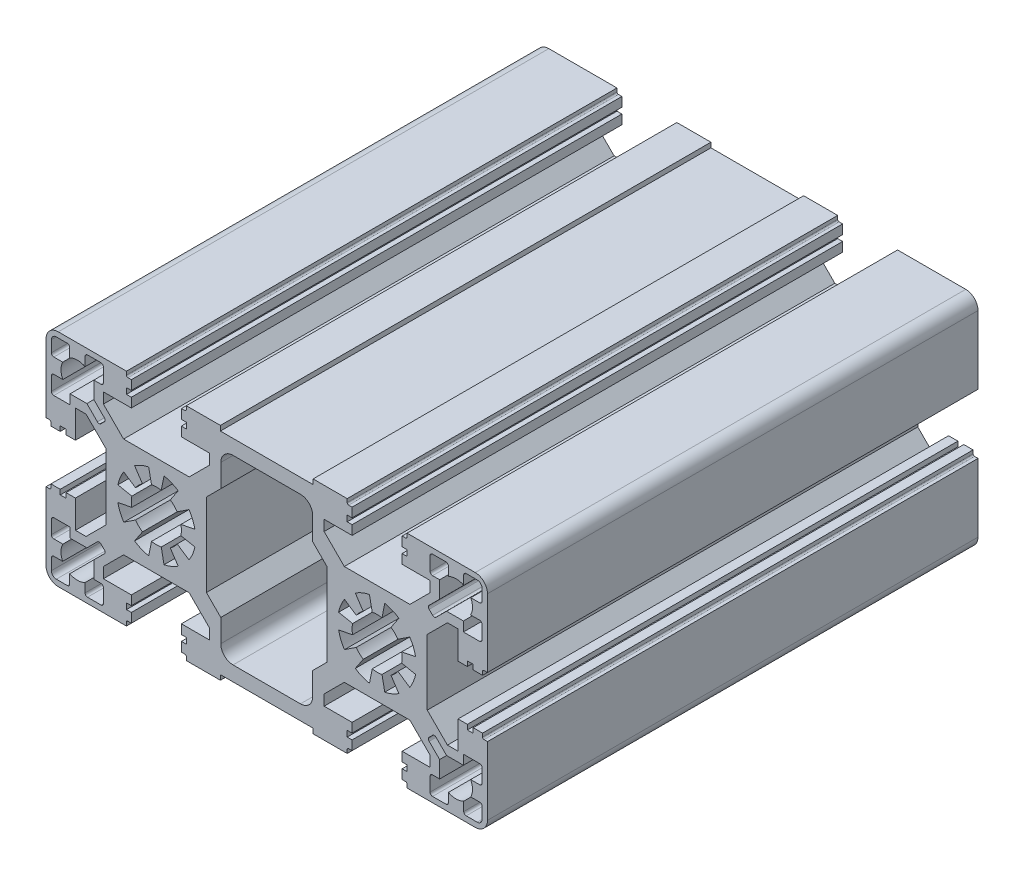
from build123d import *

# Parameters (mm, degrees)
EXTRUDE_1_DEPTH = 100


with BuildPart() as part:
    # 草图1 → 凸台-拉伸1 (new body)
    with BuildSketch(Plane.XY):
        with BuildLine():
            Line((-29.3856131, 22.954207574), (-43.2856131, 22.954207574))
            ThreePointArc((-43.2856131, 22.954207574), (-45.053380053, 22.221974527), (-45.7856131, 20.454207574))
            Line((-45.7856131, 20.454207574), (-45.7856131, 6.554207574))
            Line((-45.7856131, 6.554207574), (-45.0856131, 6.554207574))
            ThreePointArc((-45.0856131, 6.554207574), (-44.873481065, 6.466339608), (-44.7856131, 6.254207574))
            Line((-44.7856131, 6.254207574), (-44.7856131, 5.554207574))
            Line((-44.7856131, 5.554207574), (-42.8856131, 5.554207574))
            Line((-42.8856131, 5.554207574), (-42.8856131, 6.554207574))
            Line((-42.8856131, 6.554207574), (-41.6856131, 6.554207574))
            Line((-41.6856131, 6.554207574), (-41.6856131, 5.554207574))
            Line((-41.6856131, 5.554207574), (-39.7856131, 5.554207574))
            Line((-39.7856131, 5.554207574), (-39.7856131, 11.254207574))
            Line((-39.7856131, 11.254207574), (-37.621147006, 11.254207574))
            Line((-37.621147006, 11.254207574), (-33.5056131, 7.138673668))
            Line((-33.5056131, 7.138673668), (-33.5056131, -6.23025852))
            Line((-33.5056131, -6.23025852), (-37.621147006, -10.345792426))
            Line((-37.621147006, -10.345792426), (-39.7856131, -10.345792426))
            Line((-39.7856131, -10.345792426), (-39.7856131, -4.645792426))
            Line((-39.7856131, -4.645792426), (-41.6856131, -4.645792426))
            Line((-41.6856131, -4.645792426), (-41.6856131, -5.645792426))
            Line((-41.6856131, -5.645792426), (-42.8856131, -5.645792426))
            Line((-42.8856131, -5.645792426), (-42.8856131, -4.645792426))
            Line((-42.8856131, -4.645792426), (-44.7856131, -4.645792426))
            Line((-44.7856131, -4.645792426), (-44.7856131, -5.345792426))
            ThreePointArc((-44.7856131, -5.345792426), (-44.873481065, -5.557924461), (-45.0856131, -5.645792426))
            Line((-45.0856131, -5.645792426), (-45.7856131, -5.645792426))
            Line((-45.7856131, -5.645792426), (-45.7856131, -19.545792426))
            ThreePointArc((-45.7856131, -19.545792426), (-45.053380053, -21.313559379), (-43.2856131, -22.045792426))
            Line((-43.2856131, -22.045792426), (-29.3856131, -22.045792426))
            Line((-29.3856131, -22.045792426), (-29.3856131, -21.345792426))
            ThreePointArc((-29.3856131, -21.345792426), (-29.297745134, -21.133660392), (-29.0856131, -21.045792426))
            Line((-29.0856131, -21.045792426), (-28.3856131, -21.045792426))
            Line((-28.3856131, -21.045792426), (-28.3856131, -19.145792426))
            Line((-28.3856131, -19.145792426), (-29.3856131, -19.145792426))
            Line((-29.3856131, -19.145792426), (-29.3856131, -17.945792426))
            Line((-29.3856131, -17.945792426), (-28.3856131, -17.945792426))
            Line((-28.3856131, -17.945792426), (-28.3856131, -16.045792426))
            Line((-28.3856131, -16.045792426), (-34.0856131, -16.045792426))
            Line((-34.0856131, -16.045792426), (-34.0856131, -13.881326332))
            Line((-34.0856131, -13.881326332), (-29.970079194, -9.765792426))
            Line((-29.970079194, -9.765792426), (-16.601147006, -9.765792426))
            Line((-16.601147006, -9.765792426), (-12.4856131, -13.881326332))
            Line((-12.4856131, -13.881326332), (-12.4856131, -16.045792426))
            Line((-12.4856131, -16.045792426), (-18.1856131, -16.045792426))
            Line((-18.1856131, -16.045792426), (-18.1856131, -17.945792426))
            Line((-18.1856131, -17.945792426), (-17.1856131, -17.945792426))
            Line((-17.1856131, -17.945792426), (-17.1856131, -19.145792426))
            Line((-17.1856131, -19.145792426), (-18.1856131, -19.145792426))
            Line((-18.1856131, -19.145792426), (-18.1856131, -21.045792426))
            Line((-18.1856131, -21.045792426), (-17.4856131, -21.045792426))
            ThreePointArc((-17.4856131, -21.045792426), (-17.273481065, -21.133660392), (-17.1856131, -21.345792426))
            Line((-17.1856131, -21.345792426), (-17.1856131, -22.045792426))
            Line((-17.1856131, -22.045792426), (-10.2356131, -22.045792426))
            Line((-10.2356131, -22.045792426), (-10.2356131, -21.045792426))
            Line((-10.2356131, -21.045792426), (8.6643869, -21.045792426))
            Line((8.6643869, -21.045792426), (8.6643869, -22.045792426))
            Line((8.6643869, -22.045792426), (15.6143869, -22.045792426))
            Line((15.6143869, -22.045792426), (15.6143869, -21.345792426))
            ThreePointArc((15.6143869, -21.345792426), (15.702254866, -21.133660392), (15.9143869, -21.045792426))
            Line((15.9143869, -21.045792426), (16.6143869, -21.045792426))
            Line((16.6143869, -21.045792426), (16.6143869, -19.145792426))
            Line((16.6143869, -19.145792426), (15.6143869, -19.145792426))
            Line((15.6143869, -19.145792426), (15.6143869, -17.945792426))
            Line((15.6143869, -17.945792426), (16.6143869, -17.945792426))
            Line((16.6143869, -17.945792426), (16.6143869, -16.045792426))
            Line((16.6143869, -16.045792426), (10.9143869, -16.045792426))
            Line((10.9143869, -16.045792426), (10.9143869, -13.881326332))
            Line((10.9143869, -13.881326332), (15.029920806, -9.765792426))
            Line((15.029920806, -9.765792426), (28.398852994, -9.765792426))
            Line((28.398852994, -9.765792426), (32.5143869, -13.881326332))
            Line((32.5143869, -13.881326332), (32.5143869, -16.045792426))
            Line((32.5143869, -16.045792426), (26.8143869, -16.045792426))
            Line((26.8143869, -16.045792426), (26.8143869, -17.945792426))
            Line((26.8143869, -17.945792426), (27.8143869, -17.945792426))
            Line((27.8143869, -17.945792426), (27.8143869, -19.145792426))
            Line((27.8143869, -19.145792426), (26.8143869, -19.145792426))
            Line((26.8143869, -19.145792426), (26.8143869, -21.045792426))
            Line((26.8143869, -21.045792426), (27.5143869, -21.045792426))
            ThreePointArc((27.5143869, -21.045792426), (27.726518935, -21.133660392), (27.8143869, -21.345792426))
            Line((27.8143869, -21.345792426), (27.8143869, -22.045792426))
            Line((27.8143869, -22.045792426), (41.7143869, -22.045792426))
            ThreePointArc((41.7143869, -22.045792426), (43.482153853, -21.313559379), (44.2143869, -19.545792426))
            Line((44.2143869, -19.545792426), (44.2143869, -5.645792426))
            Line((44.2143869, -5.645792426), (43.5143869, -5.645792426))
            ThreePointArc((43.5143869, -5.645792426), (43.302254866, -5.557924461), (43.2143869, -5.345792426))
            Line((43.2143869, -5.345792426), (43.2143869, -4.645792426))
            Line((43.2143869, -4.645792426), (41.3143869, -4.645792426))
            Line((41.3143869, -4.645792426), (41.3143869, -5.645792426))
            Line((41.3143869, -5.645792426), (40.1143869, -5.645792426))
            Line((40.1143869, -5.645792426), (40.1143869, -4.645792426))
            Line((40.1143869, -4.645792426), (38.2143869, -4.645792426))
            Line((38.2143869, -4.645792426), (38.2143869, -10.345792426))
            Line((38.2143869, -10.345792426), (36.049920806, -10.345792426))
            Line((36.049920806, -10.345792426), (31.9343869, -6.23025852))
            Line((31.9343869, -6.23025852), (31.9343869, 7.138673668))
            Line((31.9343869, 7.138673668), (36.049920806, 11.254207574))
            Line((36.049920806, 11.254207574), (38.2143869, 11.254207574))
            Line((38.2143869, 11.254207574), (38.2143869, 5.554207574))
            Line((38.2143869, 5.554207574), (40.1143869, 5.554207574))
            Line((40.1143869, 5.554207574), (40.1143869, 6.554207574))
            Line((40.1143869, 6.554207574), (41.3143869, 6.554207574))
            Line((41.3143869, 6.554207574), (41.3143869, 5.554207574))
            Line((41.3143869, 5.554207574), (43.2143869, 5.554207574))
            Line((43.2143869, 5.554207574), (43.2143869, 6.254207574))
            ThreePointArc((43.2143869, 6.254207574), (43.302254866, 6.466339608), (43.5143869, 6.554207574))
            Line((43.5143869, 6.554207574), (44.2143869, 6.554207574))
            Line((44.2143869, 6.554207574), (44.2143869, 20.454207574))
            ThreePointArc((44.2143869, 20.454207574), (43.482153853, 22.221974527), (41.7143869, 22.954207574))
            Line((41.7143869, 22.954207574), (27.8143869, 22.954207574))
            Line((27.8143869, 22.954207574), (27.8143869, 22.254207574))
            ThreePointArc((27.8143869, 22.254207574), (27.726518935, 22.042075539), (27.5143869, 21.954207574))
            Line((27.5143869, 21.954207574), (26.8143869, 21.954207574))
            Line((26.8143869, 21.954207574), (26.8143869, 20.054207574))
            Line((26.8143869, 20.054207574), (27.8143869, 20.054207574))
            Line((27.8143869, 20.054207574), (27.8143869, 18.854207574))
            Line((27.8143869, 18.854207574), (26.8143869, 18.854207574))
            Line((26.8143869, 18.854207574), (26.8143869, 16.954207574))
            Line((26.8143869, 16.954207574), (32.5143869, 16.954207574))
            Line((32.5143869, 16.954207574), (32.5143869, 14.78974148))
            Line((32.5143869, 14.78974148), (28.398852994, 10.674207574))
            Line((28.398852994, 10.674207574), (15.029920806, 10.674207574))
            Line((15.029920806, 10.674207574), (10.9143869, 14.78974148))
            Line((10.9143869, 14.78974148), (10.9143869, 16.954207574))
            Line((10.9143869, 16.954207574), (16.6143869, 16.954207574))
            Line((16.6143869, 16.954207574), (16.6143869, 18.854207574))
            Line((16.6143869, 18.854207574), (15.6143869, 18.854207574))
            Line((15.6143869, 18.854207574), (15.6143869, 20.054207574))
            Line((15.6143869, 20.054207574), (16.6143869, 20.054207574))
            Line((16.6143869, 20.054207574), (16.6143869, 21.954207574))
            Line((16.6143869, 21.954207574), (15.9143869, 21.954207574))
            ThreePointArc((15.9143869, 21.954207574), (15.702254866, 22.042075539), (15.6143869, 22.254207574))
            Line((15.6143869, 22.254207574), (15.6143869, 22.954207574))
            Line((15.6143869, 22.954207574), (8.6643869, 22.954207574))
            Line((8.6643869, 22.954207574), (8.6643869, 21.954207574))
            Line((8.6643869, 21.954207574), (-10.2356131, 21.954207574))
            Line((-10.2356131, 21.954207574), (-10.2356131, 22.954207574))
            Line((-10.2356131, 22.954207574), (-17.1856131, 22.954207574))
            Line((-17.1856131, 22.954207574), (-17.1856131, 22.254207574))
            ThreePointArc((-17.1856131, 22.254207574), (-17.273481065, 22.042075539), (-17.4856131, 21.954207574))
            Line((-17.4856131, 21.954207574), (-18.1856131, 21.954207574))
            Line((-18.1856131, 21.954207574), (-18.1856131, 20.054207574))
            Line((-18.1856131, 20.054207574), (-17.1856131, 20.054207574))
            Line((-17.1856131, 20.054207574), (-17.1856131, 18.854207574))
            Line((-17.1856131, 18.854207574), (-18.1856131, 18.854207574))
            Line((-18.1856131, 18.854207574), (-18.1856131, 16.954207574))
            Line((-18.1856131, 16.954207574), (-12.4856131, 16.954207574))
            Line((-12.4856131, 16.954207574), (-12.4856131, 14.78974148))
            Line((-12.4856131, 14.78974148), (-16.601147006, 10.674207574))
            Line((-16.601147006, 10.674207574), (-29.970079194, 10.674207574))
            Line((-29.970079194, 10.674207574), (-34.0856131, 14.78974148))
            Line((-34.0856131, 14.78974148), (-34.0856131, 16.954207574))
            Line((-34.0856131, 16.954207574), (-28.3856131, 16.954207574))
            Line((-28.3856131, 16.954207574), (-28.3856131, 18.854207574))
            Line((-28.3856131, 18.854207574), (-29.3856131, 18.854207574))
            Line((-29.3856131, 18.854207574), (-29.3856131, 20.054207574))
            Line((-29.3856131, 20.054207574), (-28.3856131, 20.054207574))
            Line((-28.3856131, 20.054207574), (-28.3856131, 21.954207574))
            Line((-28.3856131, 21.954207574), (-29.0856131, 21.954207574))
            ThreePointArc((-29.0856131, 21.954207574), (-29.297745134, 22.042075539), (-29.3856131, 22.254207574))
            Line((-29.3856131, 22.254207574), (-29.3856131, 22.954207574))
        make_face()
        with BuildLine():
            Line((-27.730174964, -6.197549325), (-26.119021288, -3.786287449))
            ThreePointArc((-26.119021288, -3.786287449), (-26.891857684, -3.15203701), (-27.526108122, -2.379200615))
            Line((-27.526108122, -2.379200615), (-29.937369998, -3.990354291))
            ThreePointArc((-29.937369998, -3.990354291), (-30.67664936, -2.607259885), (-31.131895343, -1.106515003))
            Line((-31.131895343, -1.106515003), (-28.28761803, -0.540753069))
            ThreePointArc((-28.28761803, -0.540753069), (-28.3856131, 0.454207574), (-28.28761803, 1.449168216))
            Line((-28.28761803, 1.449168216), (-31.131895343, 2.01493015))
            ThreePointArc((-31.131895343, 2.01493015), (-30.67664936, 3.515675033), (-29.937369998, 4.898769438))
            Line((-29.937369998, 4.898769438), (-27.526108122, 3.287615762))
            ThreePointArc((-27.526108122, 3.287615762), (-26.891857684, 4.060452158), (-26.119021288, 4.694702596))
            Line((-26.119021288, 4.694702596), (-27.730174964, 7.105964472))
            ThreePointArc((-27.730174964, 7.105964472), (-26.347080559, 7.845243834), (-24.846335676, 8.300489817))
            Line((-24.846335676, 8.300489817), (-24.280573742, 5.456212504))
            ThreePointArc((-24.280573742, 5.456212504), (-23.2856131, 5.554207574), (-22.290652457, 5.456212504))
            Line((-22.290652457, 5.456212504), (-21.724890523, 8.300489817))
            ThreePointArc((-21.724890523, 8.300489817), (-20.224145641, 7.845243834), (-18.841051235, 7.105964472))
            Line((-18.841051235, 7.105964472), (-20.452204911, 4.694702596))
            ThreePointArc((-20.452204911, 4.694702596), (-19.679368516, 4.060452158), (-19.045118077, 3.287615762))
            Line((-19.045118077, 3.287615762), (-16.633856201, 4.898769438))
            ThreePointArc((-16.633856201, 4.898769438), (-15.89457684, 3.515675033), (-15.439330856, 2.01493015))
            Line((-15.439330856, 2.01493015), (-18.28360817, 1.449168216))
            ThreePointArc((-18.28360817, 1.449168216), (-18.1856131, 0.454207574), (-18.28360817, -0.540753069))
            Line((-18.28360817, -0.540753069), (-15.439330856, -1.106515003))
            ThreePointArc((-15.439330856, -1.106515003), (-15.89457684, -2.607259885), (-16.633856201, -3.990354291))
            Line((-16.633856201, -3.990354291), (-19.045118077, -2.379200615))
            ThreePointArc((-19.045118077, -2.379200615), (-19.679368516, -3.15203701), (-20.452204911, -3.786287449))
            Line((-20.452204911, -3.786287449), (-18.841051235, -6.197549325))
            ThreePointArc((-18.841051235, -6.197549325), (-20.224145641, -6.936828686), (-21.724890523, -7.39207467))
            Line((-21.724890523, -7.39207467), (-22.290652457, -4.547797356))
            ThreePointArc((-22.290652457, -4.547797356), (-23.2856131, -4.645792426), (-24.280573742, -4.547797356))
            Line((-24.280573742, -4.547797356), (-24.846335676, -7.39207467))
            ThreePointArc((-24.846335676, -7.39207467), (-26.347080559, -6.936828686), (-27.730174964, -6.197549325))
        make_face(mode=Mode.SUBTRACT)
        with BuildLine():
            Line((-44.6856131, 20.854207574), (-44.6856131, 18.554207574))
            ThreePointArc((-44.6856131, 18.554207574), (-44.53916649, 18.200654183), (-44.1856131, 18.054207574))
            Line((-44.1856131, 18.054207574), (-42.38102626, 18.054207574))
            ThreePointArc((-42.38102626, 18.054207574), (-42.735443358, 16.520484569), (-42.350220999, 14.994207574))
            Line((-42.350220999, 14.994207574), (-44.1856131, 14.994207574))
            ThreePointArc((-44.1856131, 14.994207574), (-44.53916649, 14.847760964), (-44.6856131, 14.494207574))
            Line((-44.6856131, 14.494207574), (-44.6856131, 11.754207574))
            ThreePointArc((-44.6856131, 11.754207574), (-44.53916649, 11.400654183), (-44.1856131, 11.254207574))
            Line((-44.1856131, 11.254207574), (-40.8856131, 11.254207574))
            Line((-40.8856131, 11.254207574), (-40.8856131, 13.204207574))
            Line((-40.8856131, 13.204207574), (-37.449826662, 13.204207574))
            Line((-37.449826662, 13.204207574), (-35.30642838, 11.060809292))
            ThreePointArc((-35.30642838, 11.060809292), (-34.952874989, 10.914362682), (-34.599321598, 11.060809292))
            Line((-34.599321598, 11.060809292), (-33.892214816, 11.767916075))
            ThreePointArc((-33.892214816, 11.767916075), (-33.745768207, 12.121469465), (-33.892214816, 12.475022856))
            Line((-33.892214816, 12.475022856), (-36.035613096, 14.618421136))
            Line((-36.035613096, 14.618421136), (-36.035613096, 18.054207574))
            Line((-36.035613096, 18.054207574), (-34.5856131, 18.054207574))
            ThreePointArc((-34.5856131, 18.054207574), (-34.232059709, 18.200654183), (-34.0856131, 18.554207574))
            Line((-34.0856131, 18.554207574), (-34.0856131, 21.354207574))
            ThreePointArc((-34.0856131, 21.354207574), (-34.232059709, 21.707760964), (-34.5856131, 21.854207574))
            Line((-34.5856131, 21.854207574), (-37.3256131, 21.854207574))
            ThreePointArc((-37.3256131, 21.854207574), (-37.67916649, 21.707760964), (-37.8256131, 21.354207574))
            Line((-37.8256131, 21.354207574), (-37.8256131, 19.518815474))
            ThreePointArc((-37.8256131, 19.518815474), (-39.3856131, 19.904207574), (-40.9456131, 19.518815474))
            Line((-40.9456131, 19.518815474), (-40.9456131, 21.354207574))
            ThreePointArc((-40.9456131, 21.354207574), (-41.092059709, 21.707760964), (-41.4456131, 21.854207574))
            Line((-41.4456131, 21.854207574), (-43.6856131, 21.854207574))
            ThreePointArc((-43.6856131, 21.854207574), (-44.392719881, 21.561314355), (-44.6856131, 20.854207574))
        make_face(mode=Mode.SUBTRACT)
        with BuildLine():
            Line((-36.035613096, -17.120797774), (-34.5856131, -17.120797774))
            ThreePointArc((-34.5856131, -17.120797774), (-34.232059709, -17.267244384), (-34.0856131, -17.620797774))
            Line((-34.0856131, -17.620797774), (-34.0856131, -20.420797774))
            ThreePointArc((-34.0856131, -20.420797774), (-34.232059709, -20.774351165), (-34.5856131, -20.920797774))
            Line((-34.5856131, -20.920797774), (-37.3256131, -20.920797774))
            ThreePointArc((-37.3256131, -20.920797774), (-37.67916649, -20.774351165), (-37.8256131, -20.420797774))
            Line((-37.8256131, -20.420797774), (-37.8256131, -18.585405674))
            ThreePointArc((-37.8256131, -18.585405674), (-39.3856131, -18.970797774), (-40.9456131, -18.585405674))
            Line((-40.9456131, -18.585405674), (-40.9456131, -20.420797774))
            ThreePointArc((-40.9456131, -20.420797774), (-41.092059709, -20.774351165), (-41.4456131, -20.920797774))
            Line((-41.4456131, -20.920797774), (-43.6856131, -20.920797774))
            ThreePointArc((-43.6856131, -20.920797774), (-44.392719881, -20.627904555), (-44.6856131, -19.920797774))
            Line((-44.6856131, -19.920797774), (-44.6856131, -17.620797774))
            ThreePointArc((-44.6856131, -17.620797774), (-44.53916649, -17.267244384), (-44.1856131, -17.120797774))
            Line((-44.1856131, -17.120797774), (-42.38102626, -17.120797774))
            ThreePointArc((-42.38102626, -17.120797774), (-42.735443358, -15.58707477), (-42.350220999, -14.060797774))
            Line((-42.350220999, -14.060797774), (-44.1856131, -14.060797774))
            ThreePointArc((-44.1856131, -14.060797774), (-44.53916649, -13.914351165), (-44.6856131, -13.560797774))
            Line((-44.6856131, -13.560797774), (-44.6856131, -10.820797774))
            ThreePointArc((-44.6856131, -10.820797774), (-44.53916649, -10.467244384), (-44.1856131, -10.320797774))
            Line((-44.1856131, -10.320797774), (-40.8856131, -10.320797774))
            Line((-40.8856131, -10.320797774), (-40.8856131, -12.270797774))
            Line((-40.8856131, -12.270797774), (-37.449826662, -12.270797774))
            Line((-37.449826662, -12.270797774), (-35.30642838, -10.127399492))
            ThreePointArc((-35.30642838, -10.127399492), (-34.952874989, -9.980952883), (-34.599321598, -10.127399493))
            Line((-34.599321598, -10.127399493), (-33.892214816, -10.834506275))
            ThreePointArc((-33.892214816, -10.834506275), (-33.745768207, -11.188059666), (-33.892214816, -11.541613056))
            Line((-33.892214816, -11.541613056), (-36.035613096, -13.685011336))
            Line((-36.035613096, -13.685011336), (-36.035613096, -17.120797774))
        make_face(mode=Mode.SUBTRACT)
        with BuildLine():
            Line((17.269825036, -6.197549325), (18.880978712, -3.786287449))
            ThreePointArc((18.880978712, -3.786287449), (18.108142316, -3.15203701), (17.473891878, -2.379200615))
            Line((17.473891878, -2.379200615), (15.062630002, -3.990354291))
            ThreePointArc((15.062630002, -3.990354291), (14.32335064, -2.607259885), (13.868104657, -1.106515003))
            Line((13.868104657, -1.106515003), (16.71238197, -0.540753069))
            ThreePointArc((16.71238197, -0.540753069), (16.6143869, 0.454207574), (16.71238197, 1.449168216))
            Line((16.71238197, 1.449168216), (13.868104657, 2.01493015))
            ThreePointArc((13.868104657, 2.01493015), (14.32335064, 3.515675033), (15.062630002, 4.898769438))
            Line((15.062630002, 4.898769438), (17.473891878, 3.287615762))
            ThreePointArc((17.473891878, 3.287615762), (18.108142316, 4.060452158), (18.880978712, 4.694702596))
            Line((18.880978712, 4.694702596), (17.269825036, 7.105964472))
            ThreePointArc((17.269825036, 7.105964472), (18.652919441, 7.845243834), (20.153664324, 8.300489817))
            Line((20.153664324, 8.300489817), (20.719426258, 5.456212504))
            ThreePointArc((20.719426258, 5.456212504), (21.7143869, 5.554207574), (22.709347543, 5.456212504))
            Line((22.709347543, 5.456212504), (23.275109477, 8.300489817))
            ThreePointArc((23.275109477, 8.300489817), (24.775854359, 7.845243834), (26.158948765, 7.105964472))
            Line((26.158948765, 7.105964472), (24.547795089, 4.694702596))
            ThreePointArc((24.547795089, 4.694702596), (25.320631484, 4.060452158), (25.954881923, 3.287615762))
            Line((25.954881923, 3.287615762), (28.366143799, 4.898769438))
            ThreePointArc((28.366143799, 4.898769438), (29.10542316, 3.515675033), (29.560669144, 2.01493015))
            Line((29.560669144, 2.01493015), (26.71639183, 1.449168216))
            ThreePointArc((26.71639183, 1.449168216), (26.8143869, 0.454207574), (26.71639183, -0.540753069))
            Line((26.71639183, -0.540753069), (29.560669144, -1.106515003))
            ThreePointArc((29.560669144, -1.106515003), (29.10542316, -2.607259885), (28.366143799, -3.990354291))
            Line((28.366143799, -3.990354291), (25.954881923, -2.379200615))
            ThreePointArc((25.954881923, -2.379200615), (25.320631484, -3.15203701), (24.547795089, -3.786287449))
            Line((24.547795089, -3.786287449), (26.158948765, -6.197549325))
            ThreePointArc((26.158948765, -6.197549325), (24.775854359, -6.936828686), (23.275109477, -7.39207467))
            Line((23.275109477, -7.39207467), (22.709347543, -4.547797356))
            ThreePointArc((22.709347543, -4.547797356), (21.7143869, -4.645792426), (20.719426258, -4.547797356))
            Line((20.719426258, -4.547797356), (20.153664324, -7.39207467))
            ThreePointArc((20.153664324, -7.39207467), (18.652919441, -6.936828686), (17.269825036, -6.197549325))
        make_face(mode=Mode.SUBTRACT)
        with BuildLine():
            Line((34.4643869, 18.054207574), (33.0143869, 18.054207574))
            ThreePointArc((33.0143869, 18.054207574), (32.66083351, 18.200654183), (32.5143869, 18.554207574))
            Line((32.5143869, 18.554207574), (32.5143869, 21.354207574))
            ThreePointArc((32.5143869, 21.354207574), (32.66083351, 21.707760964), (33.0143869, 21.854207574))
            Line((33.0143869, 21.854207574), (35.7543869, 21.854207574))
            ThreePointArc((35.7543869, 21.854207574), (36.107940291, 21.707760964), (36.2543869, 21.354207574))
            Line((36.2543869, 21.354207574), (36.2543869, 19.518815474))
            ThreePointArc((36.2543869, 19.518815474), (37.8143869, 19.904207574), (39.3743869, 19.518815474))
            Line((39.3743869, 19.518815474), (39.3743869, 21.354207574))
            ThreePointArc((39.3743869, 21.354207574), (39.52083351, 21.707760964), (39.8743869, 21.854207574))
            Line((39.8743869, 21.854207574), (42.1143869, 21.854207574))
            ThreePointArc((42.1143869, 21.854207574), (42.821493682, 21.561314355), (43.1143869, 20.854207574))
            Line((43.1143869, 20.854207574), (43.1143869, 18.554207574))
            ThreePointArc((43.1143869, 18.554207574), (42.967940291, 18.200654183), (42.6143869, 18.054207574))
            Line((42.6143869, 18.054207574), (40.809800061, 18.054207574))
            ThreePointArc((40.809800061, 18.054207574), (41.164217159, 16.520484569), (40.7789948, 14.994207574))
            Line((40.7789948, 14.994207574), (42.6143869, 14.994207574))
            ThreePointArc((42.6143869, 14.994207574), (42.967940291, 14.847760964), (43.1143869, 14.494207574))
            Line((43.1143869, 14.494207574), (43.1143869, 11.754207574))
            ThreePointArc((43.1143869, 11.754207574), (42.967940291, 11.400654183), (42.6143869, 11.254207574))
            Line((42.6143869, 11.254207574), (39.3143869, 11.254207574))
            Line((39.3143869, 11.254207574), (39.3143869, 13.204207574))
            Line((39.3143869, 13.204207574), (35.878600466, 13.204207574))
            Line((35.878600466, 13.204207574), (33.735202184, 11.060809292))
            ThreePointArc((33.735202184, 11.060809292), (33.381648793, 10.914362682), (33.028095402, 11.060809293))
            Line((33.028095402, 11.060809293), (32.32098862, 11.767916075))
            ThreePointArc((32.32098862, 11.767916075), (32.174542011, 12.121469465), (32.32098862, 12.475022856))
            Line((32.32098862, 12.475022856), (34.4643869, 14.618421136))
            Line((34.4643869, 14.618421136), (34.4643869, 18.054207574))
        make_face(mode=Mode.SUBTRACT)
        with BuildLine():
            Line((34.4643869, -17.120797774), (33.0143869, -17.120797774))
            ThreePointArc((33.0143869, -17.120797774), (32.66083351, -17.267244384), (32.5143869, -17.620797774))
            Line((32.5143869, -17.620797774), (32.5143869, -20.420797774))
            ThreePointArc((32.5143869, -20.420797774), (32.66083351, -20.774351165), (33.0143869, -20.920797774))
            Line((33.0143869, -20.920797774), (35.7543869, -20.920797774))
            ThreePointArc((35.7543869, -20.920797774), (36.107940291, -20.774351165), (36.2543869, -20.420797774))
            Line((36.2543869, -20.420797774), (36.2543869, -18.585405674))
            ThreePointArc((36.2543869, -18.585405674), (37.8143869, -18.970797774), (39.3743869, -18.585405674))
            Line((39.3743869, -18.585405674), (39.3743869, -20.420797774))
            ThreePointArc((39.3743869, -20.420797774), (39.52083351, -20.774351165), (39.8743869, -20.920797774))
            Line((39.8743869, -20.920797774), (42.1143869, -20.920797774))
            ThreePointArc((42.1143869, -20.920797774), (42.821493682, -20.627904555), (43.1143869, -19.920797774))
            Line((43.1143869, -19.920797774), (43.1143869, -17.620797774))
            ThreePointArc((43.1143869, -17.620797774), (42.967940291, -17.267244384), (42.6143869, -17.120797774))
            Line((42.6143869, -17.120797774), (40.809800061, -17.120797774))
            ThreePointArc((40.809800061, -17.120797774), (41.164217159, -15.58707477), (40.7789948, -14.060797774))
            Line((40.7789948, -14.060797774), (42.6143869, -14.060797774))
            ThreePointArc((42.6143869, -14.060797774), (42.967940291, -13.914351165), (43.1143869, -13.560797774))
            Line((43.1143869, -13.560797774), (43.1143869, -10.820797774))
            ThreePointArc((43.1143869, -10.820797774), (42.967940291, -10.467244384), (42.6143869, -10.320797774))
            Line((42.6143869, -10.320797774), (39.314386904, -10.320797774))
            Line((39.314386904, -10.320797774), (39.314386904, -12.270797774))
            Line((39.314386904, -12.270797774), (35.878600466, -12.270797774))
            Line((35.878600466, -12.270797774), (33.735202184, -10.127399492))
            ThreePointArc((33.735202184, -10.127399492), (33.381648793, -9.980952883), (33.028095402, -10.127399493))
            Line((33.028095402, -10.127399493), (32.32098862, -10.834506275))
            ThreePointArc((32.32098862, -10.834506275), (32.174542011, -11.188059666), (32.32098862, -11.541613056))
            Line((32.32098862, -11.541613056), (34.4643869, -13.685011336))
            Line((34.4643869, -13.685011336), (34.4643869, -17.120797774))
        make_face(mode=Mode.SUBTRACT)
        with BuildLine():
            Line((-10.156247896, 11.815805825), (-10.156247896, 16.454207574))
            ThreePointArc((-10.156247896, 16.454207574), (-9.424014849, 18.221974527), (-7.656247896, 18.954207574))
            Line((-7.656247896, 18.954207574), (6.085021696, 18.954207574))
            ThreePointArc((6.085021696, 18.954207574), (7.852788649, 18.221974527), (8.585021696, 16.454207574))
            Line((8.585021696, 16.454207574), (8.585021696, 11.815805825))
            Line((8.585021696, 11.815805825), (11.5143869, 8.886440621))
            Line((11.5143869, 8.886440621), (11.5143869, -7.978025473))
            Line((11.5143869, -7.978025473), (8.585021696, -10.907390677))
            Line((8.585021696, -10.907390677), (8.585021696, -15.545792426))
            ThreePointArc((8.585021696, -15.545792426), (7.852788649, -17.313559379), (6.085021696, -18.045792426))
            Line((6.085021696, -18.045792426), (-7.656247896, -18.045792426))
            ThreePointArc((-7.656247896, -18.045792426), (-9.424014849, -17.313559379), (-10.156247896, -15.545792426))
            Line((-10.156247896, -15.545792426), (-10.156247896, -10.907390677))
            Line((-10.156247896, -10.907390677), (-13.0856131, -7.978025473))
            Line((-13.0856131, -7.978025473), (-13.0856131, 8.886440621))
            Line((-13.0856131, 8.886440621), (-10.156247896, 11.815805825))
        make_face(mode=Mode.SUBTRACT)
    extrude(amount=EXTRUDE_1_DEPTH)


solid = part.part
